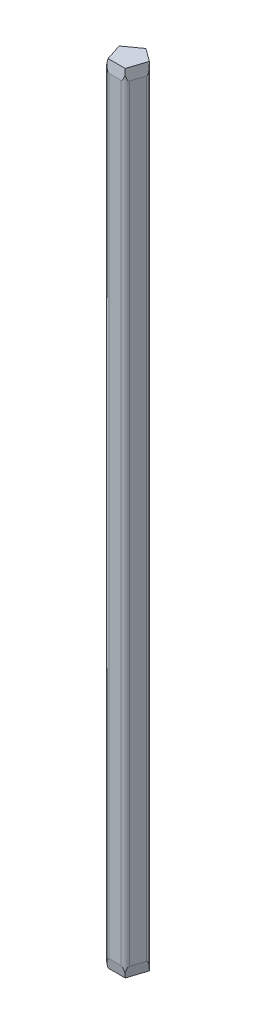
from build123d import *
from OCP.BRepFilletAPI import BRepFilletAPI_MakeChamfer

# Parameters (mm, degrees)
BOSS_EXTRUDE1_DEPTH = 300
CHAMFER1_SIZE       = 4
CHAMFER1_SIZE2      = 0.705307923
FILLET2_R           = 1.9
FILLET3_R           = 1.3
FILLET4_R           = 2.2


with BuildPart() as part:
    # Sketch1 → Boss-Extrude1 (new body)
    with BuildSketch(Plane(origin=(0, 0, 0), x_dir=(1, 0, 0), z_dir=(0, 1, 0))):
        Polygon((0, 6.443679873), (-6.128303732, 1.991206587), (-3.7875, -5.213046524), (3.7875, -5.213046524), (6.128303732, 1.991206587), align=None)
    extrude(amount=BOSS_EXTRUDE1_DEPTH)

    # Chamfer1: one chamfer whose edges measure the first distance from different faces: ONE call of the kernel's chamfer builder (chamfer() names one face for all edges)
    chamfer1_edges_1 = [part.edges().sort_by_distance(p)[0] for p in [
        (4.957901866, 300, 1.610919968),
        (4.957901866, 0, 1.610919968),
    ]]
    chamfer1_side_1 = [part.faces().sort_by_distance(p)[0] for p in [
        (4.957901866, 150, 1.610919968),
    ]]
    chamfer1_edges_2 = [part.edges().sort_by_distance(p)[0] for p in [
        (0, 300, 5.213046524),
        (0, 0, 5.213046524),
    ]]
    chamfer1_side_2 = [part.faces().sort_by_distance(p)[0] for p in [
        (0, 150, 5.213046524),
    ]]
    chamfer1_edges_3 = [part.edges().sort_by_distance(p)[0] for p in [
        (-4.957901866, 300, 1.610919968),
        (-4.957901866, 0, 1.610919968),
    ]]
    chamfer1_side_3 = [part.faces().sort_by_distance(p)[0] for p in [
        (-4.957901866, 150, 1.610919968),
    ]]
    chamfer1_edges_4 = [part.edges().sort_by_distance(p)[0] for p in [
        (-3.064151866, 300, -4.21744323),
        (-3.064151866, 0, -4.21744323),
    ]]
    chamfer1_side_4 = [part.faces().sort_by_distance(p)[0] for p in [
        (-3.064151866, 150, -4.21744323),
    ]]
    chamfer1 = BRepFilletAPI_MakeChamfer(part.part.solid().wrapped)
    for e in chamfer1_edges_1:
        chamfer1.Add(CHAMFER1_SIZE, CHAMFER1_SIZE2, e.wrapped, chamfer1_side_1[0].wrapped)  # the first distance lies on this face
    for e in chamfer1_edges_2:
        chamfer1.Add(CHAMFER1_SIZE, CHAMFER1_SIZE2, e.wrapped, chamfer1_side_2[0].wrapped)  # the first distance lies on this face
    for e in chamfer1_edges_3:
        chamfer1.Add(CHAMFER1_SIZE, CHAMFER1_SIZE2, e.wrapped, chamfer1_side_3[0].wrapped)  # the first distance lies on this face
    for e in chamfer1_edges_4:
        chamfer1.Add(CHAMFER1_SIZE, CHAMFER1_SIZE2, e.wrapped, chamfer1_side_4[0].wrapped)  # the first distance lies on this face
    add(Compound.cast(chamfer1.Shape()), mode=Mode.REPLACE)

    # Fillet2
    fillet2_edges = [part.edges().sort_by_distance(p)[0] for p in [
        (3.7875, 150, 5.213046524),
        (-6.128303732, 150, -1.991206587),
    ]]
    fillet(fillet2_edges, radius=FILLET2_R)

    # Fillet3
    fillet3_edges = [part.edges().sort_by_distance(p)[0] for p in [
        (6.128303732, 150, -1.991206587),
        (0, 150, -6.443679873),
    ]]
    fillet(fillet3_edges, radius=FILLET3_R)

    # Fillet4
    fillet4_edges = [part.edges().sort_by_distance(p)[0] for p in [
        (-3.7875, 150, 5.213046524),
    ]]
    fillet(fillet4_edges, radius=FILLET4_R)


solid = part.part
